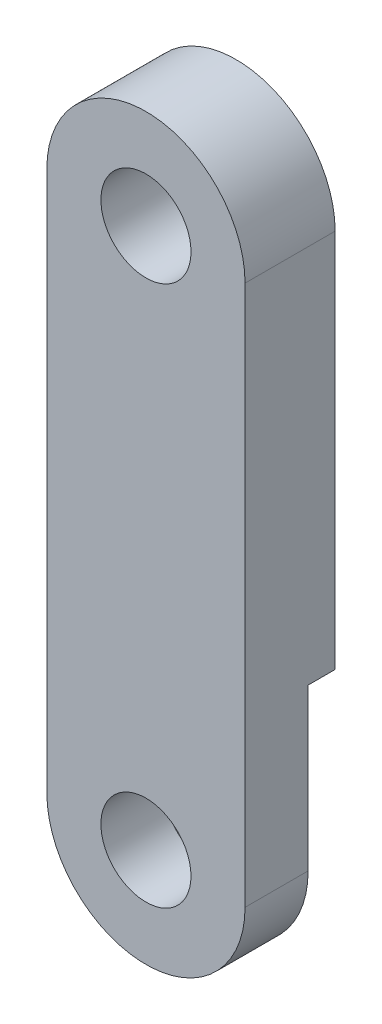
from build123d import *

# Parameters (mm, degrees)
SKETCH1_R           = 5
BOSS_EXTRUDE1_DEPTH = 10
CUT_EXTRUDE1_DEPTH  = 3


with BuildPart() as part:
    # Sketch1 → Boss-Extrude1 (new body)
    with BuildSketch(Plane(origin=(0, 0, 0), x_dir=(0, 1, 0), z_dir=(0, 0, 1))):
        with BuildLine():
            Line((0, 11), (60, 11))
            ThreePointArc((60, 11), (71, 0), (60, -11))
            Line((60, -11), (0, -11))
            ThreePointArc((0, -11), (-11, 0), (0, 11))
        make_face()
        with Locations(Location((0, 0, 0), (0, 0, 270))):
            Circle(SKETCH1_R, mode=Mode.SUBTRACT)
        with Locations(Location((60, 0, 0), (0, 0, 270))):
            Circle(SKETCH1_R, mode=Mode.SUBTRACT)
    extrude(amount=BOSS_EXTRUDE1_DEPTH)

    # Sketch2 → Cut-Extrude1 (cut)
    with BuildSketch(Plane(origin=(0, 0, 0), x_dir=(1, 0, 0), z_dir=(0, 0, -1))):
        with BuildLine():
            Line((9, -17.860571099), (11, -17.860571099))
            Line((11, -17.860571099), (11, 0))
            ThreePointArc((11, 0), (0, 11), (-11, 0))
            Line((-11, 0), (-11, -17.860571099))
            Line((-11, -17.860571099), (-9, -17.860571099))
            ThreePointArc((-9, -17.860571099), (0, -20), (9, -17.860571099))
        make_face()
    extrude(amount=-CUT_EXTRUDE1_DEPTH, mode=Mode.SUBTRACT)


solid = part.part
